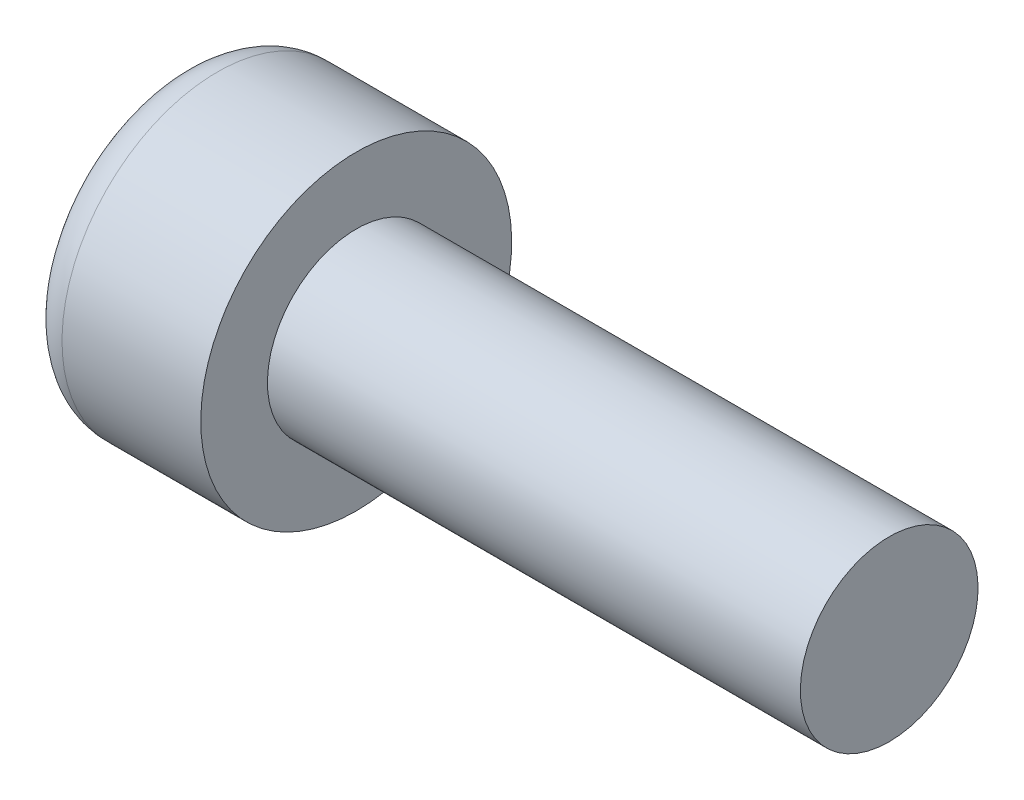
from build123d import *

# Parameters (mm, degrees)
CUT_EXTRUDE1_DEPTH = 2


with BuildPart() as part:
    # Sketch1 → Revolve1 (revolve)
    with BuildSketch(Plane.XY, mode=Mode.PRIVATE) as revolve1_sk:
        with BuildLine():
            Line((0, 0), (0, 2.625))
            ThreePointArc((0, 2.625), (0.256281566, 3.243718434), (0.875, 3.5))
            Line((0.875, 3.5), (4, 3.5))
            Line((4, 3.5), (4, 2))
            Line((4, 2), (16, 2))
            Line((16, 2), (16, 0))
            Line((16, 0), (0, 0))
        make_face()
    revolve(revolve1_sk.sketch.rotate(Axis((0, 0, 0), (1, 0, 0)), 180), axis=Axis((0, 0, 0), (1, 0, 0)))

    # Sketch2 → Cut-Extrude1 (cut)
    with BuildSketch(Plane.ZY):
        Polygon((0, 1.732050808), (-1.5, 0.866025404), (-1.5, -0.866025404), (0, -1.732050808), (1.5, -0.866025404), (1.5, 0.866025404), align=None)
    extrude(amount=-CUT_EXTRUDE1_DEPTH, mode=Mode.SUBTRACT)


solid = part.part
